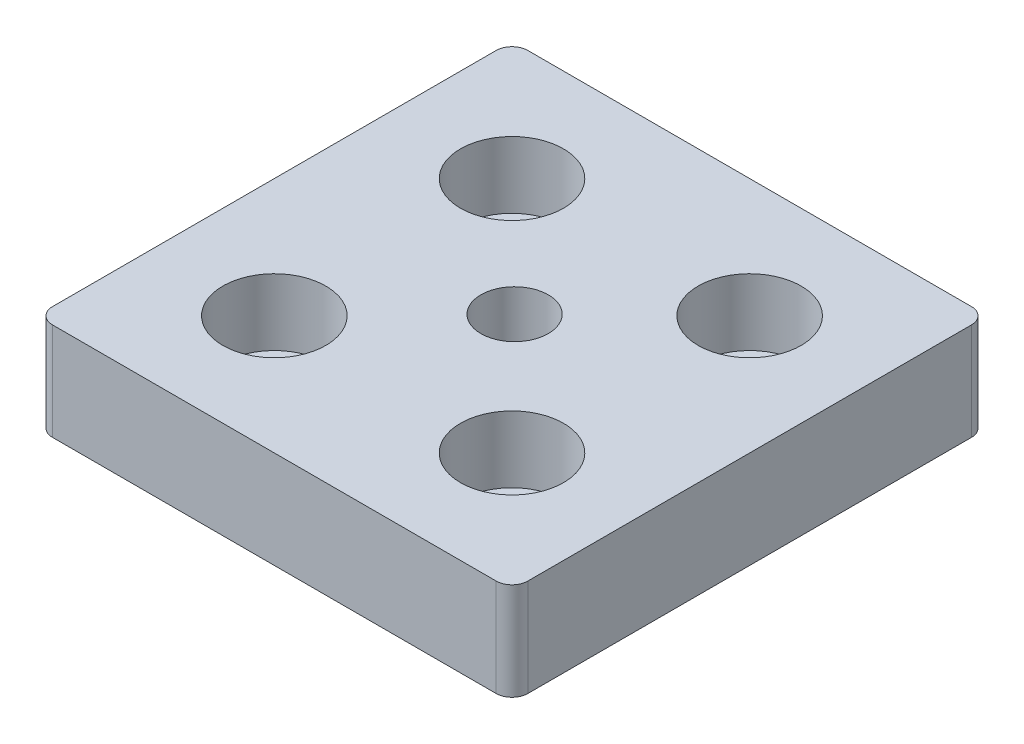
from build123d import *

# Parameters (mm, degrees)
SKETCH_1_R              = 4.5
EXTRUDE_1_DEPTH         = 12.3
HOLE_WIZARD_M10_1_D     = 8.5
HOLE_WIZARD_M10_1_DEPTH = 24.5
HOLE_WIZARD_M10_1_TIP   = 2.553657631
SKETCH_5_R              = 6.5
CUT_EXTRUDE_1_DEPTH     = 8.4


with BuildPart() as part:
    # 草图1 → 凸台-拉伸1 (new body)
    with BuildSketch(Plane(origin=(0, 0, 0), x_dir=(1, 0, 0), z_dir=(0, 1, 0))):
        with BuildLine():
            Line((-27.993607343, -30.330536434), (28.006392657, -30.330536434))
            ThreePointArc((28.006392657, -30.330536434), (29.42060622, -29.744749996), (30.006392657, -28.330536434))
            Line((30.006392657, -28.330536434), (30.006392657, 27.669463566))
            ThreePointArc((30.006392657, 27.669463566), (29.42060622, 29.083677128), (28.006392657, 29.669463566))
            Line((28.006392657, 29.669463566), (-27.993607343, 29.669463566))
            ThreePointArc((-27.993607343, 29.669463566), (-29.407820905, 29.083677128), (-29.993607343, 27.669463566))
            Line((-29.993607343, 27.669463566), (-29.993607343, -28.330536434))
            ThreePointArc((-29.993607343, -28.330536434), (-29.407820905, -29.744749996), (-27.993607343, -30.330536434))
        make_face()
        with Locations(Location((15.006392657, -15.330536434, 0), (0, 0, 270))):
            Circle(SKETCH_1_R, mode=Mode.SUBTRACT)
        with Locations(Location((15.006392657, 14.669463566, 0), (0, 0, 270))):
            Circle(SKETCH_1_R, mode=Mode.SUBTRACT)
        with Locations(Location((-14.993607343, 14.669463566, 0), (0, 0, 270))):
            Circle(SKETCH_1_R, mode=Mode.SUBTRACT)
        with Locations(Location((-14.993607343, -15.330536434, 0), (0, 0, 270))):
            Circle(SKETCH_1_R, mode=Mode.SUBTRACT)
    extrude(amount=EXTRUDE_1_DEPTH)

    # M10 螺纹孔1
    with Locations(Plane.ZX.offset(12.3)):
        with Locations((0, 0)):
            Hole(HOLE_WIZARD_M10_1_D / 2, depth=HOLE_WIZARD_M10_1_DEPTH)
            with Locations((0, 0, -(HOLE_WIZARD_M10_1_DEPTH + HOLE_WIZARD_M10_1_TIP / 2))):  # 118° drill point
                Cone(0, HOLE_WIZARD_M10_1_D / 2, HOLE_WIZARD_M10_1_TIP, mode=Mode.SUBTRACT)

    # 草图5 → 切除-拉伸1 (cut)
    with BuildSketch(Plane(origin=(0, 12.3, 0), x_dir=(1, 0, 0), z_dir=(0, 1, 0))):
        with Locations(Location((-14.993607343, 14.669463566, 0), (0, 0, 270))):
            Circle(SKETCH_5_R)
        with Locations(Location((15.006392657, 14.669463566, 0), (0, 0, 270))):
            Circle(SKETCH_5_R)
        with Locations(Location((15.006392657, -15.330536434, 0), (0, 0, 270))):
            Circle(SKETCH_5_R)
        with Locations(Location((-14.993607343, -15.330536434, 0), (0, 0, 270))):
            Circle(SKETCH_5_R)
    extrude(amount=-CUT_EXTRUDE_1_DEPTH, mode=Mode.SUBTRACT)


solid = part.part
